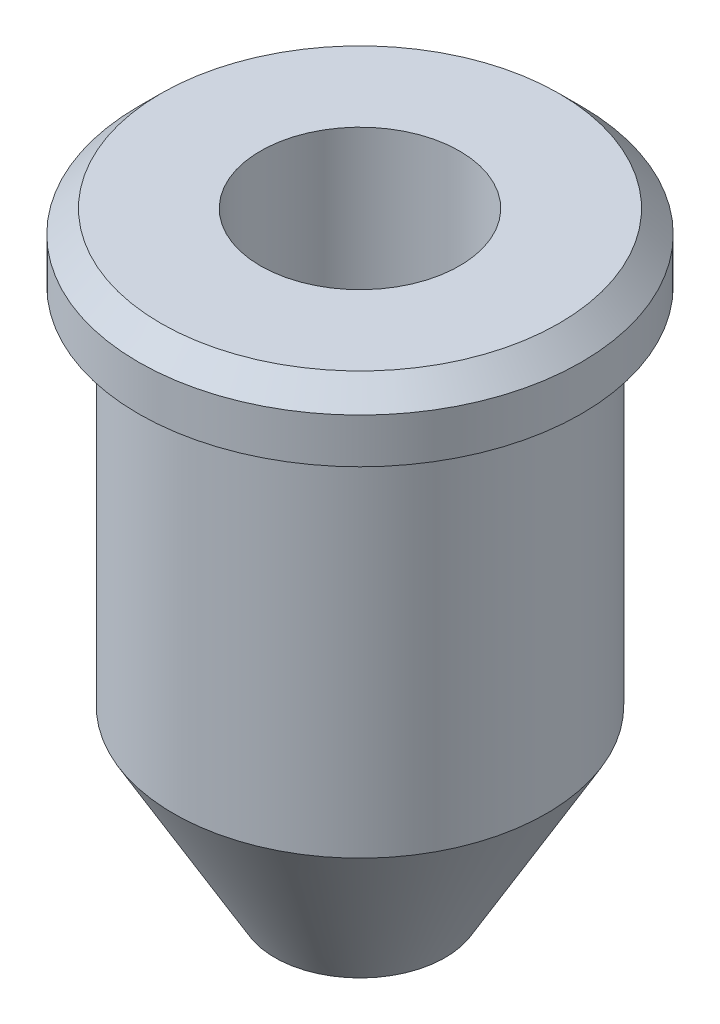
from build123d import *


with BuildPart() as part:
    # Sketch1 → Revolve2 (revolve)
    with BuildSketch(Plane.XY, mode=Mode.PRIVATE) as revolve2_sk:
        Polygon((0, 5.969), (3.3893125, 5.969), (3.3893125, 20.6375), (6.778625, 20.6375), (7.540625, 19.8755), (7.540625, 18.3515), (6.35, 18.3515), (6.35, 5.969), (2.903796243, 0), (0, 0), align=None)
    revolve(revolve2_sk.sketch.rotate(Axis((0, 0, 0), (0, 1, 0)), 90), axis=Axis((0, 0, 0), (0, 1, 0)))


solid = part.part
